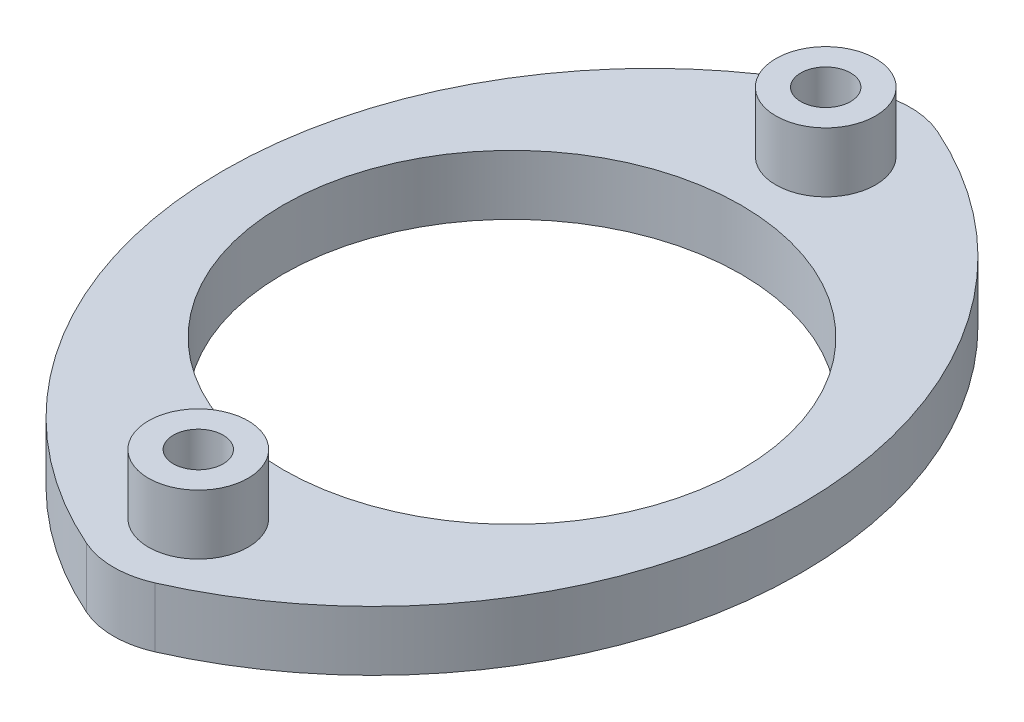
from build123d import *

# Parameters (mm, degrees)
SKETCH1_R           = 4.25
SKETCH1_R_2         = 1.25
BOSS_EXTRUDE1_DEPTH = 3
BOSS_EXTRUDE2_START = -3
SKETCH2_R           = 2.5
SKETCH2_R_2         = 1.25
BOSS_EXTRUDE2_DEPTH = 6


with BuildPart() as part:
    # Sketch1 → Boss-Extrude1 (new body)
    # profile 1 of 4: a face of its own
    with BuildSketch(Plane(origin=(0, 0, 0), x_dir=(1, 0, 0), z_dir=(0, 1, 0))):
        with BuildLine():
            ThreePointArc((1.6e-08, -11.5), (-11.5, -2.4e-08), (-3.2e-08, 11.5))
            ThreePointArc((-3.2e-08, 11.5), (-4.157986242, 14.870426004), (-1.721061947, 19.635929204))
            ThreePointArc((-1.721061947, 19.635929204), (-14.5, 0), (-1.721061947, -19.635929204))
            ThreePointArc((-1.721061947, -19.635929204), (-4.157986237, -14.87042598), (1.6e-08, -11.5))
        make_face()
    # profile 2 of 4: a face of its own
    with BuildSketch(Plane(origin=(0, 0, 0), x_dir=(1, 0, 0), z_dir=(0, 1, 0))):
        with BuildLine():
            ThreePointArc((1.721061947, 19.635929204), (3.562093014, 18.068187517), (4.25, 15.75))
            ThreePointArc((4.25, 15.75), (3.005203809, 12.744796169), (-3.2e-08, 11.5))
            ThreePointArc((-3.2e-08, 11.5), (8.131727972, 8.131727995), (11.5, 0))
            ThreePointArc((11.5, 0), (8.131727989, -8.131727978), (1.6e-08, -11.5))
            ThreePointArc((1.6e-08, -11.5), (3.005203826, -12.744796186), (4.25, -15.75))
            ThreePointArc((4.25, -15.75), (3.562093014, -18.068187517), (1.721061947, -19.635929204))
            ThreePointArc((1.721061947, -19.635929204), (14.5, 0), (1.721061947, 19.635929204))
        make_face()
    # profile 3 of 4: a face of its own
    with BuildSketch(Plane(origin=(0, 0, 0), x_dir=(1, 0, 0), z_dir=(0, 1, 0))):
        with Locations((0, 15.75)):
            Circle(SKETCH1_R)
        with Locations(Location((0, 15.75, 0), (0, 0, 270))):
            Circle(SKETCH1_R_2, mode=Mode.SUBTRACT)
    # profile 4 of 4: a face of its own
    with BuildSketch(Plane(origin=(0, 0, 0), x_dir=(1, 0, 0), z_dir=(0, 1, 0))):
        with Locations((0, -15.75)):
            Circle(SKETCH1_R)
        with Locations(Location((0, -15.75, 0), (0, 0, 270))):
            Circle(SKETCH1_R_2, mode=Mode.SUBTRACT)
    extrude(amount=BOSS_EXTRUDE1_DEPTH)

    # Sketch2 → Boss-Extrude2 (add)
    with BuildSketch(Plane(origin=(0, 3, 0), x_dir=(1, 0, 0), z_dir=(0, 1, 0)).offset(BOSS_EXTRUDE2_START)):
        with Locations(Location((0, 15.75, 0), (0, 0, 270))):
            Circle(SKETCH2_R)
        with Locations(Location((0, 15.75, 0), (0, 0, 270))):
            Circle(SKETCH2_R_2, mode=Mode.SUBTRACT)
    boss_extrude2 = extrude(amount=BOSS_EXTRUDE2_DEPTH)

    # Mirror1: Boss-Extrude2 across plane
    add(boss_extrude2.mirror(Plane.XY))


solid = part.part
